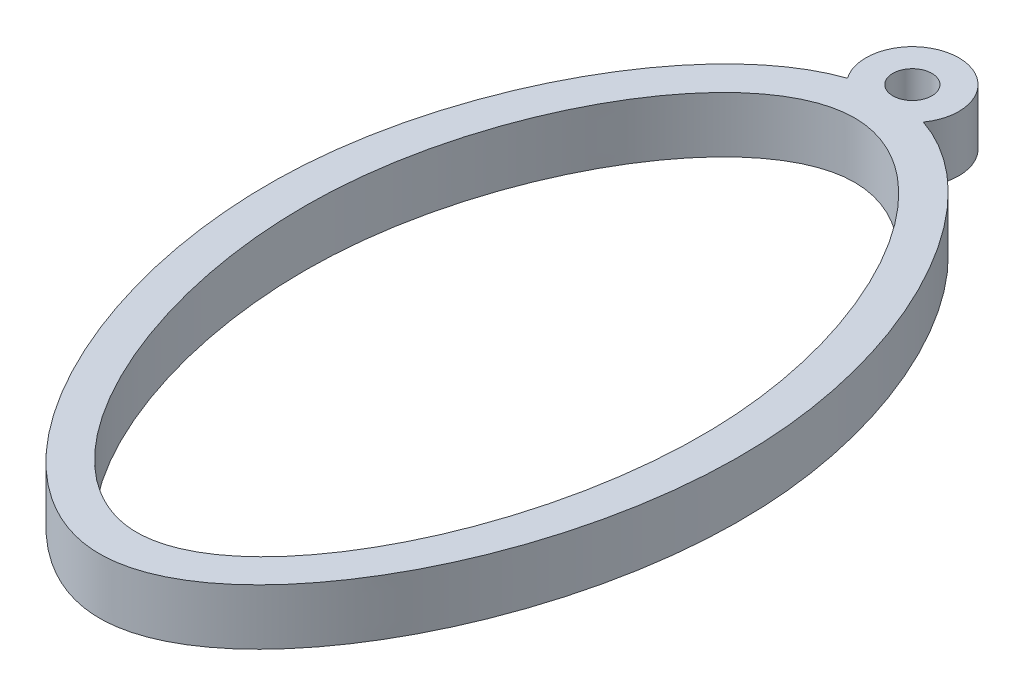
from build123d import *

# Parameters (mm, degrees)
SKETCH1_R           = 1.05
BOSS_EXTRUDE1_DEPTH = 3


with BuildPart() as part:
    # Sketch1 → Boss-Extrude1 (new body)
    # profile 1 of 2: a face of its own
    with BuildSketch(Plane(origin=(0, 0, 0), x_dir=(1, 0, 0), z_dir=(0, 1, 0))):
        with BuildLine():
            add(Edge.make_bspline(
                [(0, 19.37225), (0.682051251, 19.37225), (1.364102503, 19.25208178), (2.038250623, 19.024653924)],
                knots=[0, 0, 0, 0, 0.026283335, 0.026283335, 0.026283335, 0.026283335], degree=3))
            ThreePointArc((2.038250623, 19.024653924), (0, 22.97225), (-2.038250623, 19.024653924))
            add(Edge.make_bspline(
                [(-2.038250623, 19.024653924), (-1.364102503, 19.25208178), (-0.682051251, 19.37225), (0, 19.37225)],
                knots=[0.973716665, 0.973716665, 0.973716665, 0.973716665, 1, 1, 1, 1], degree=3))
        make_face()
        with Locations(Location((0, 20.47225, 0), (0, 0, 270))):
            Circle(SKETCH1_R, mode=Mode.SUBTRACT)
    # profile 2 of 2: a face of its own
    with BuildSketch(Plane(origin=(0, 0, 0), x_dir=(1, 0, 0), z_dir=(0, 1, 0))):
        with BuildLine():
            add(Edge.make_bspline(
                [(0, 19.37225), (6.053317743, 19.37225), (19.028293147, -0.916515404), (0, -35.137615431), (-19.028293147, -0.916515404), (-6.053317743, 19.37225), (0, 19.37225)],
                knots=[0, 0, 0, 0, 0.233268949, 0.5, 0.766731051, 1, 1, 1, 1], degree=3))
        make_face()
        with BuildLine():
            add(Edge.make_bspline(
                [(0, 17.37225), (5.065349214, 17.37225), (16.036138704, -1.020603978), (0, -32.112698185), (-16.036138704, -1.020603978), (-5.065349214, 17.37225), (0, 17.37225)],
                knots=[0, 0, 0, 0, 0.230856185, 0.5, 0.769143815, 1, 1, 1, 1], degree=3))
        make_face(mode=Mode.SUBTRACT)
    extrude(amount=BOSS_EXTRUDE1_DEPTH)


solid = part.part
